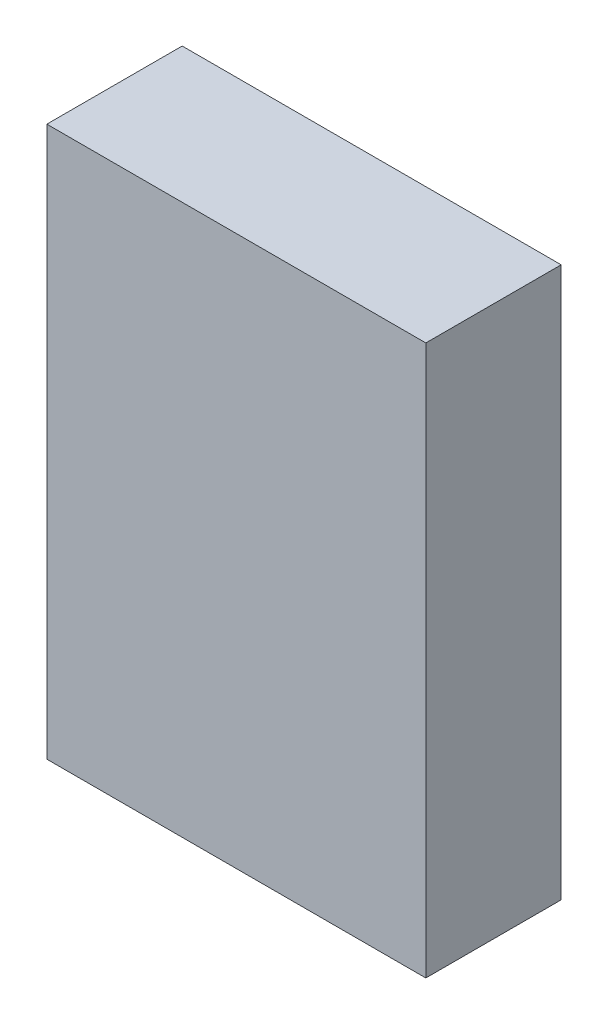
from build123d import *

# Parameters (mm, degrees)
ESQUISSE1_W             = 2.8
ESQUISSE1_H             = 4.0635
COMPONENT_OUTLINE_DEPTH = 1


with BuildPart() as part:
    # Esquisse1 → Component_Outline (new body)
    with BuildSketch(Plane.XY):
        with Locations((0.1, 0.03175)):
            Rectangle(ESQUISSE1_W, ESQUISSE1_H)
    extrude(amount=COMPONENT_OUTLINE_DEPTH)


solid = part.part
